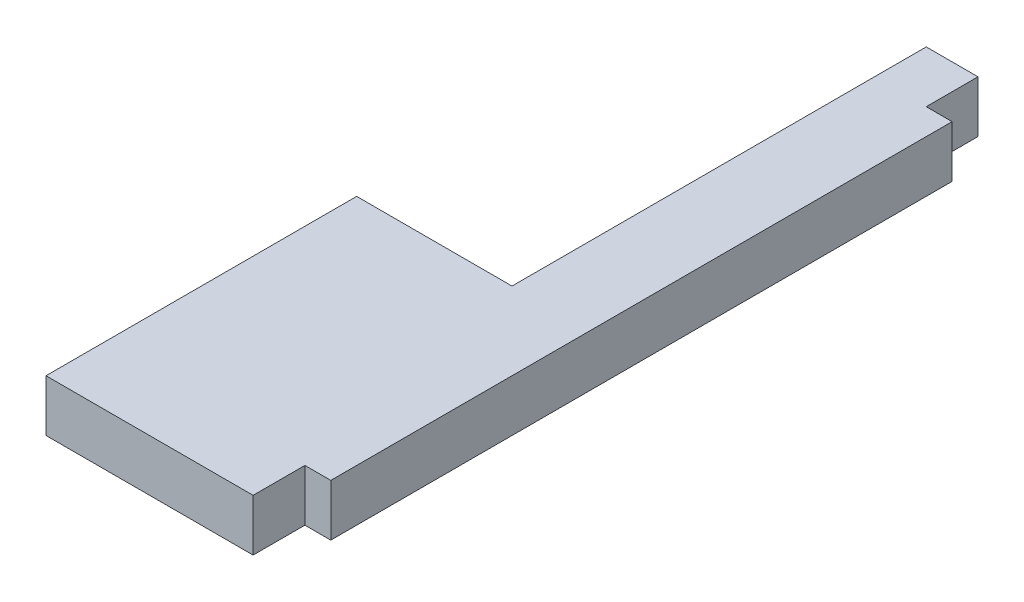
from build123d import *

# Parameters (mm, degrees)
BOSS_EXTRUDE1_DEPTH = 10


with BuildPart() as part:
    # Sketch2 → Boss-Extrude1 (new body)
    with BuildSketch(Plane(origin=(0, 0, 0), x_dir=(1, 0, 0), z_dir=(0, 1, 0))):
        Polygon((0, 0), (40, 0), (40, 10), (45, 10), (45, 130), (40, 130), (40, 140), (30, 140), (30, 60), (0, 60), align=None)
    extrude(amount=BOSS_EXTRUDE1_DEPTH)


solid = part.part
